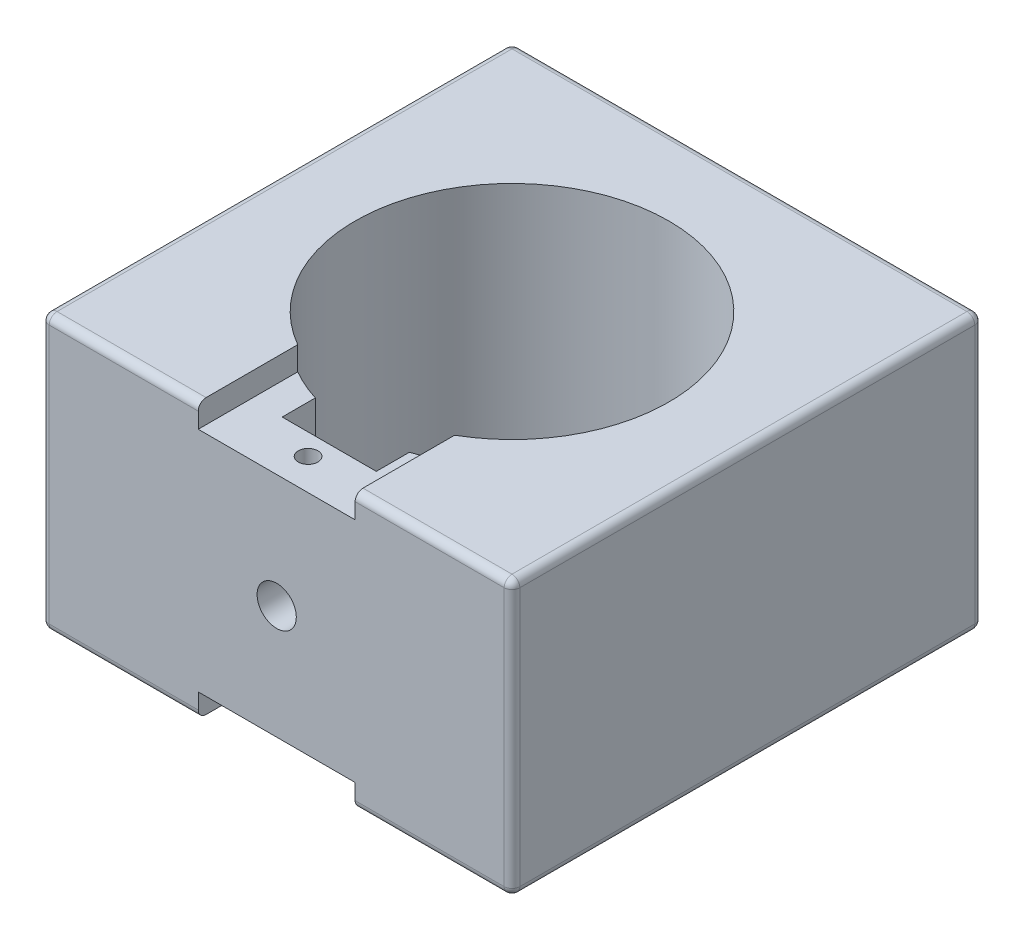
from build123d import *

# Parameters (mm, degrees)
ESQUISSE1_W             = 60
ESQUISSE1_H             = 60
ESQUISSE1_R             = 20
BOSS_EXTRU_1_DEPTH      = 35
CONG_1_R                = 1
TROU_TARAUD_M61_REACH   = 77.664
TROU_TARAUD_M61_BORE_R  = 2.5
TROU_TARAUD_M41_D       = 3.3
TROU_TARAUD_M41_DEPTH   = 7.5
TROU_TARAUD_M41_TIP     = 0.991420021
TROU_TARAUD_M42_D       = 3.3
TROU_TARAUD_M42_DEPTH   = 10.5
TROU_TARAUD_M42_TIP     = 0.991420021
ENL_V_MAT_EXTRU_1_REACH = 57
ENL_V_MAT_EXTRU_2_DEPTH = 3


with BuildPart() as part:
    # Esquisse1 → Boss.-Extru.1 (new body)
    with BuildSketch(Plane(origin=(0, 0, 0), x_dir=(1, 0, 0), z_dir=(0, 1, 0))):
        Rectangle(ESQUISSE1_W, ESQUISSE1_H)
        with Locations(Location((0, 0, 0), (0, 0, 270))):
            Circle(ESQUISSE1_R, mode=Mode.SUBTRACT)
    extrude(amount=BOSS_EXTRU_1_DEPTH)

    # Congé1
    cong_1_edges = [part.edges().sort_by_distance(p)[0] for p in [
        (30, 35, 0),
        (0, 35, -30),
        (-30, 35, 0),
        (0, 0, -30),
        (30, 0, 0),
        (0, 0, 30),
        (-30, 0, 0),
        (0, 35, 30),
        (-30, 17.5, -30),
        (30, 17.5, -30),
        (30, 17.5, 30),
        (-30, 17.5, 30),
    ]]
    fillet(cong_1_edges, radius=CONG_1_R)

    # Trou taraudé M61 bore → Trou taraudé M61 (cut, up to next)
    with BuildSketch(Plane.XY.offset(30), mode=Mode.PRIVATE) as trou_taraud_m61_sk1:
        with Locations((0, 17.5)):
            Circle(TROU_TARAUD_M61_BORE_R)
    trou_taraud_m61_tool1 = extrude(trou_taraud_m61_sk1.sketch, amount=-TROU_TARAUD_M61_REACH, mode=Mode.PRIVATE) & part.part
    add(trou_taraud_m61_tool1.solids().sort_by_distance((0, 17.5, 30))[0], mode=Mode.SUBTRACT)

    # Trou taraudé M41
    with Locations(Plane(origin=(0, 0, -30), x_dir=(-1, 0, 0), z_dir=(0, 0, -1))):
        with Locations((0, 29.2), (0, 5.8)):
            Hole(TROU_TARAUD_M41_D / 2, depth=TROU_TARAUD_M41_DEPTH)
            with Locations((0, 0, -(TROU_TARAUD_M41_DEPTH + TROU_TARAUD_M41_TIP / 2))):  # 118° drill point
                Cone(0, TROU_TARAUD_M41_D / 2, TROU_TARAUD_M41_TIP, mode=Mode.SUBTRACT)

    # Trou taraudé M42
    with Locations(Plane.ZY.offset(30)):
        with Locations((-9.666666667, 17.5)):
            Hole(TROU_TARAUD_M42_D / 2, depth=TROU_TARAUD_M42_DEPTH)
            with Locations((0, 0, -(TROU_TARAUD_M42_DEPTH + TROU_TARAUD_M42_TIP / 2))):  # 118° drill point
                Cone(0, TROU_TARAUD_M42_D / 2, TROU_TARAUD_M42_TIP, mode=Mode.SUBTRACT)

    # Esquisse10 → Enlèv. mat.-Extru.1 (cut, up to next)
    with BuildSketch(Plane.XZ, mode=Mode.PRIVATE) as enl_v_mat_extru_1_sk1:
        with BuildLine():
            Line((6, 23.3), (6, 19.078784028))
            ThreePointArc((6, 19.078784028), (0, 20), (-6, 19.078784028))
            Line((-6, 19.078784028), (-6, 23.3))
            Line((-6, 23.3), (6, 23.3))
        make_face()
    enl_v_mat_extru_1_tool1 = extrude(enl_v_mat_extru_1_sk1.sketch, amount=-ENL_V_MAT_EXTRU_1_REACH, mode=Mode.PRIVATE) & part.part
    add(enl_v_mat_extru_1_tool1.solids().sort_by_distance((0, 0, 21.487514))[0], mode=Mode.SUBTRACT)

    # Esquisse11 → Enlèv. mat.-Extru.2 (cut)
    with BuildSketch(Plane.XZ):
        with BuildLine():
            Line((-10, 30), (-10, 17.320508076))
            ThreePointArc((-10, 17.320508076), (0, 20), (10, 17.320508076))
            Line((10, 17.320508076), (10, 30))
            Line((10, 30), (-10, 30))
        make_face()
    enl_v_mat_extru_2 = extrude(amount=-ENL_V_MAT_EXTRU_2_DEPTH, mode=Mode.SUBTRACT)

    # Esquisse13 → Trou taraudé M31 (revolve, cut)
    with BuildSketch(Plane(origin=(0, 3, 26), x_dir=(0, 0, -1), z_dir=(1, 0, 0))):
        Polygon((0, 0), (0, 9.251075774), (1.25, 8.5), (1.25, 0), align=None)
    trou_taraud_m31 = revolve(axis=Axis((0, -3.35, 26), (0, 1, 0)), mode=Mode.SUBTRACT)

    # Symétrie1: Enlèv. mat.-Extru.2, Trou taraudé M31 across plane
    add(enl_v_mat_extru_2.mirror(Plane(origin=(0, 17.5, 0), x_dir=(0, 0, 1), z_dir=(0, -1, 0))), mode=Mode.SUBTRACT)
    add(trou_taraud_m31.mirror(Plane(origin=(0, 17.5, 0), x_dir=(0, 0, 1), z_dir=(0, -1, 0))), mode=Mode.SUBTRACT)


solid = part.part
